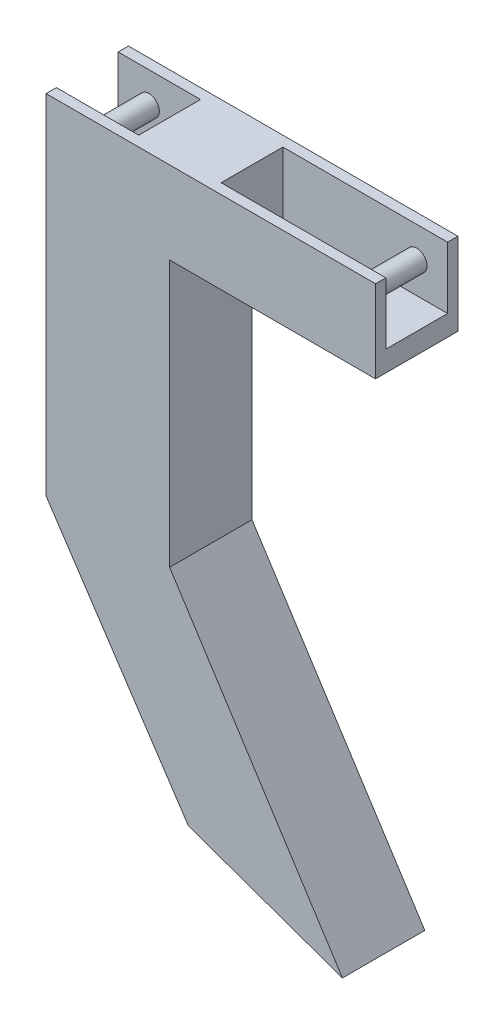
from build123d import *

# Parameters (mm, degrees)
BOSS_EXTRUDE2_DEPTH = 40
SKETCH2_W           = 40
SKETCH2_H           = 30
CUT_EXTRUDE1_DEPTH  = 30
SKETCH3_R           = 5
BOSS_EXTRUDE3_DEPTH = 30
SKETCH4_W           = 80
SKETCH4_H           = 30
CUT_EXTRUDE2_DEPTH  = 30
SKETCH5_R           = 5
BOSS_EXTRUDE4_DEPTH = 30


with BuildPart() as part:
    # Sketch1 → Boss-Extrude2 (new body)
    with BuildSketch(Plane.XY):
        Polygon((106.666666667, 22.215384615), (106.666666667, 62.215384615), (-53.333333333, 62.215384615), (-53.333333333, -107.008547009), (15.753846154, -211.2), (90.584615385, -237.784615385), (6.666666667, -107.008547009), (6.666666667, 22.215384615), align=None)
    extrude(amount=BOSS_EXTRUDE2_DEPTH)

    # Sketch2 → Cut-Extrude1 (cut)
    with BuildSketch(Plane(origin=(0, 62.215384615, 0), x_dir=(1, 0, 0), z_dir=(0, 1, 0))):
        with Locations((-33.333333333, -20)):
            Rectangle(SKETCH2_W, SKETCH2_H)
    extrude(amount=-CUT_EXTRUDE1_DEPTH, mode=Mode.SUBTRACT)

    # Sketch3 → Boss-Extrude3 (add)
    with BuildSketch(Plane.XY.offset(5)):
        with Locations(Location((-38.333333333, 47.215384615, 0), (0, 0, 180))):
            Circle(SKETCH3_R)
    extrude(amount=BOSS_EXTRUDE3_DEPTH)

    # Sketch4 → Cut-Extrude2 (cut)
    with BuildSketch(Plane(origin=(0, 62.215384615, 0), x_dir=(1, 0, 0), z_dir=(0, 1, 0))):
        with Locations((66.666666667, -20)):
            Rectangle(SKETCH4_W, SKETCH4_H)
    extrude(amount=-CUT_EXTRUDE2_DEPTH, mode=Mode.SUBTRACT)

    # Sketch5 → Boss-Extrude4 (add)
    with BuildSketch(Plane.XY.offset(5)):
        with Locations(Location((91.666666667, 47.215384615, 0), (0, 0, 180))):
            Circle(SKETCH5_R)
    extrude(amount=BOSS_EXTRUDE4_DEPTH)


solid = part.part
